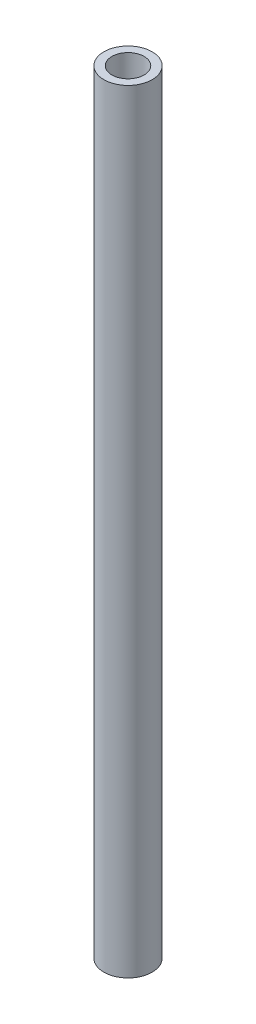
from build123d import *

# Parameters (mm, degrees)
SKETCH1_R           = 9.525
SKETCH1_R_2         = 6.35
BOSS_EXTRUDE1_DEPTH = 304.8


with BuildPart() as part:
    # Sketch1 → Boss-Extrude1 (new body)
    with BuildSketch(Plane(origin=(0, 0, 0), x_dir=(1, 0, 0), z_dir=(0, 1, 0))):
        with Locations(Location((0, 0, 0), (0, 0, 90))):
            Circle(SKETCH1_R)
        with Locations(Location((0, 0, 0), (0, 0, 90))):
            Circle(SKETCH1_R_2, mode=Mode.SUBTRACT)
    extrude(amount=BOSS_EXTRUDE1_DEPTH)


solid = part.part
